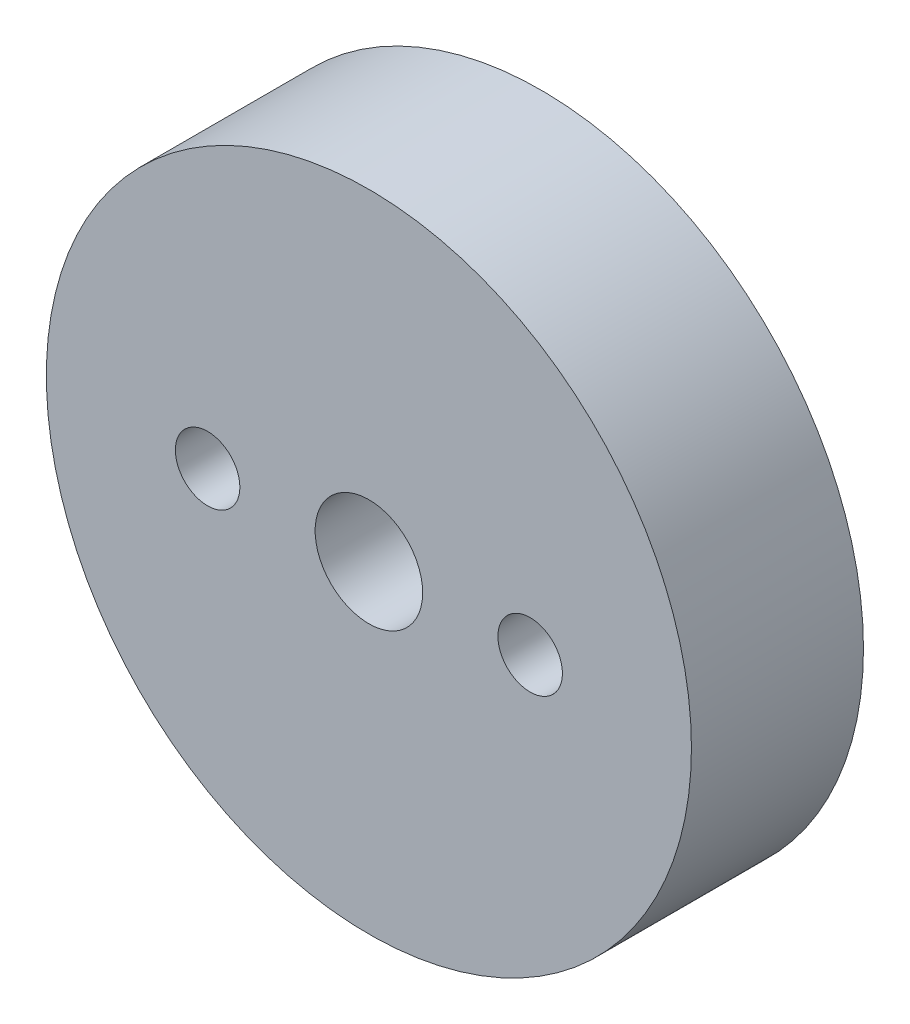
from build123d import *

# Parameters (mm, degrees)
SKETCH1_R           = 15
SKETCH1_R_2         = 2.5
SKETCH1_R_3         = 1.5
BOSS_EXTRUDE1_DEPTH = 8


with BuildPart() as part:
    # Sketch1 → Boss-Extrude1 (new body)
    with BuildSketch(Plane.XY):
        Circle(SKETCH1_R)
        Circle(SKETCH1_R_2, mode=Mode.SUBTRACT)
        with Locations((7.5, 0)):
            Circle(SKETCH1_R_3, mode=Mode.SUBTRACT)
        with Locations((-7.5, 0)):
            Circle(SKETCH1_R_3, mode=Mode.SUBTRACT)
    extrude(amount=BOSS_EXTRUDE1_DEPTH)


solid = part.part
